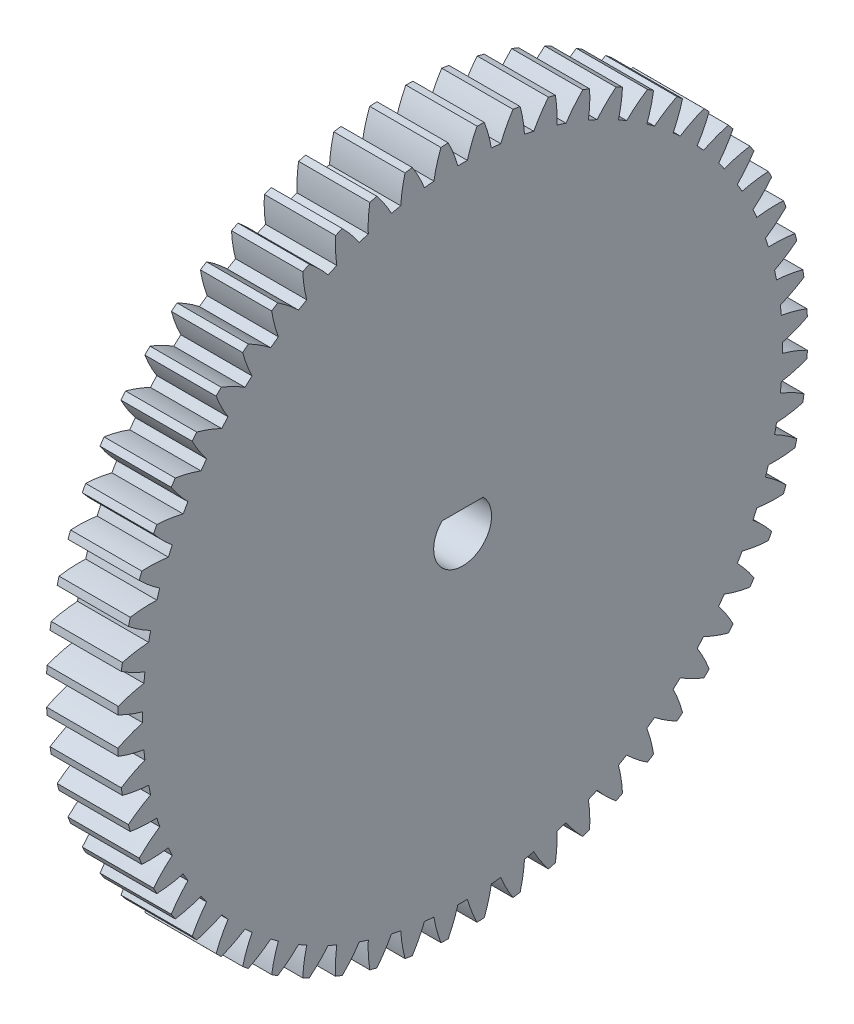
from build123d import *

# Parameters (mm, degrees)
BASPROSKE_W         = 8
BASPROSKE_H         = 38.75
TOOTHCUT_DEPTH      = 56.381630529
TEETHCUTS_COUNT     = 60
TEETHCUTS_ANGLE     = 354
BORSKE_R            = 3.5
BORE_DEPTH          = 50.0000508
SKETCH1_R           = 3.5
BOSS_EXTRUDE1_DEPTH = 8


with BuildPart() as part:
    # BasProSke → Base-Revolve (revolve)
    with BuildSketch(Plane(origin=(0, 0, 0), x_dir=(1, 0, 0), z_dir=(0, 1, 0)), mode=Mode.PRIVATE) as base_revolve_sk:
        with Locations((4, 19.375)):
            Rectangle(BASPROSKE_W, BASPROSKE_H)
    revolve(base_revolve_sk.sketch.rotate(Axis((-10, 0, 0), (1, 0, 0)), 180), axis=Axis((-10, 0, 0), (1, 0, 0)))

    # TooCutSke → ToothCut (cut, through all)
    with BuildSketch(Plane(origin=(0, 0, 0), x_dir=(0, 0, -1), z_dir=(1, 0, 0))):
        with BuildLine():
            ThreePointArc((0.53356623, 35.932538726), (0, 35.9365), (-0.53356623, 35.932538726))
            ThreePointArc((-0.53356623, 35.932538726), (-1.012587985, 37.364472092), (-1.6331416, 38.74099242))
            ThreePointArc((-1.6331416, 38.74099242), (0, 38.7754), (1.6331416, 38.74099242))
            ThreePointArc((1.6331416, 38.74099242), (1.012587985, 37.364472092), (0.53356623, 35.932538726))
        make_face()
    toothcut = extrude(amount=TOOTHCUT_DEPTH, mode=Mode.SUBTRACT)

    # TeethCuts: ToothCut ×60 about axis
    teethcuts_axis = Axis((-10, 0, 0), (1, 0, 0))
    for i in range(1, TEETHCUTS_COUNT):
        add(toothcut.rotate(teethcuts_axis, i * TEETHCUTS_ANGLE / (TEETHCUTS_COUNT - 1)), mode=Mode.SUBTRACT)

    # BorSke → Bore (cut, symmetric)
    with BuildSketch(Plane(origin=(0, 0, 0), x_dir=(0, 0, -1), z_dir=(1, 0, 0))):
        with Locations(Location((0, 0, 0), (0, 0, 180))):
            Circle(BORSKE_R)
    extrude(amount=BORE_DEPTH, both=True, mode=Mode.SUBTRACT)

    # Sketch1 → Boss-Extrude1 (add)
    with BuildSketch(Plane(origin=(8, 0, 0), x_dir=(0, 0, -1), z_dir=(1, 0, 0))):
        Circle(SKETCH1_R)
        with BuildLine():
            ThreePointArc((2.309761892, 2.286372673), (0, -3.25), (-2.309761892, 2.286372673))
            Line((-2.309761892, 2.286372673), (2.309761892, 2.286372673))
        make_face(mode=Mode.SUBTRACT)
    extrude(amount=-BOSS_EXTRUDE1_DEPTH)


solid = part.part
